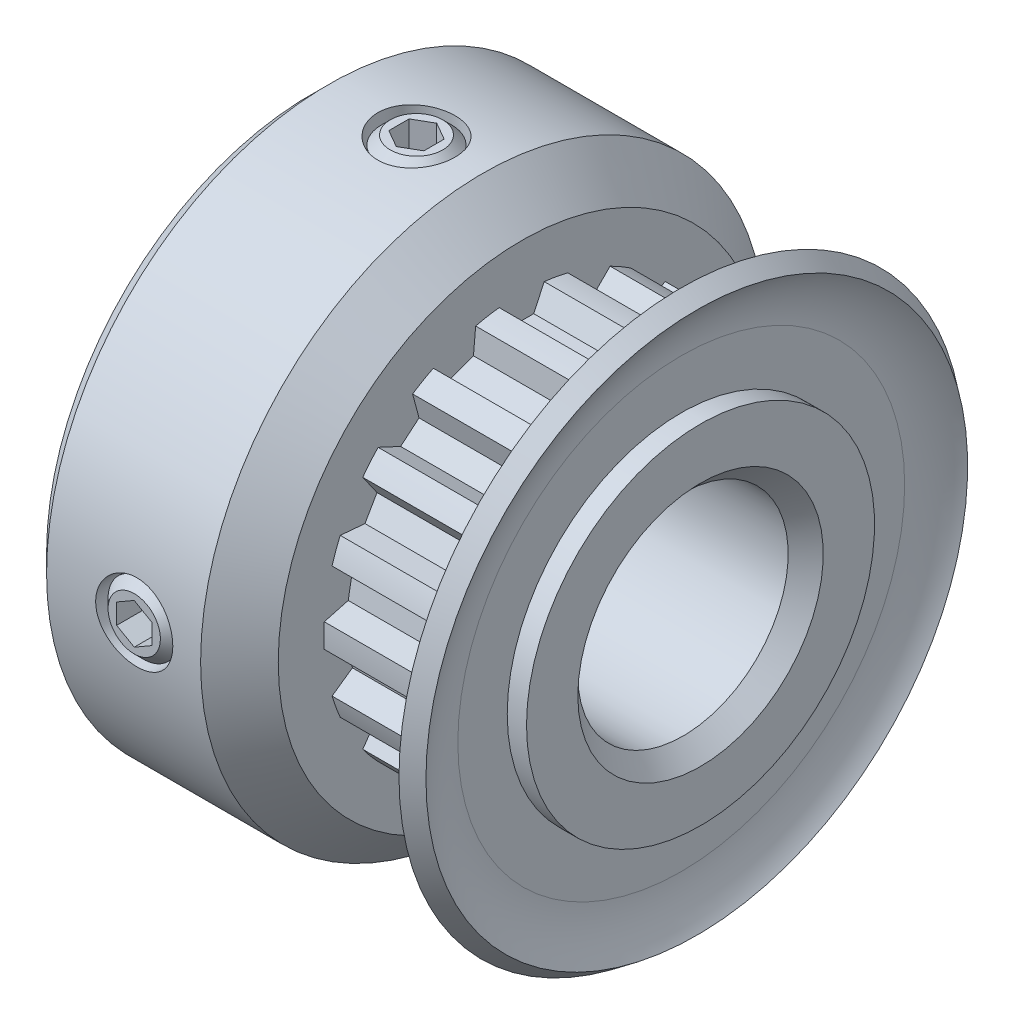
from build123d import *

# Parameters (mm, degrees)
SKETCH4_R          = 5.8
SKETCH4_R_2        = 5.64125
CUT_EXTRUDE2_DEPTH = 4
CUT_EXTRUDE1_DEPTH = 4
CIRPATTERN1_COUNT  = 18
SKETCH6_R          = 1.1
CUT_EXTRUDE3_DEPTH = 13.665208249
CUT_EXTRUDE4_DEPTH = 1.016
CIRPATTERN2_COUNT  = 2
CIRPATTERN2_ANGLE  = 90
CIRPATTERN3_COUNT  = 2
CIRPATTERN3_ANGLE  = 90
CHAMFER1_SIZE      = 0.5


with BuildPart() as part:
    # Sketch1 → Revolve1 (revolve)
    with BuildSketch(Plane.XY, mode=Mode.PRIVATE) as revolve1_sk:
        with BuildLine():
            Line((-5.55, 3), (5.55, 3))
            Line((5.55, 3), (5.55, 8.05))
            Line((5.55, 8.05), (5, 8.05))
            ThreePointArc((5, 8.05), (4.59100507, 7.25465659), (4.45, 6.3715))
            Line((4.45, 6.3715), (4.45, 5.8))
            Line((4.45, 5.8), (0.45, 5.8))
            Line((0.45, 5.8), (0.45, 6.943))
            Line((0.45, 6.943), (-0.657, 8.05))
            Line((-0.657, 8.05), (-5.55, 8.05))
            Line((-5.55, 8.05), (-5.55, 3))
        make_face()
    revolve(revolve1_sk.sketch.rotate(Axis((-5.55, 0, 0), (1, 0, 0)), 90), axis=Axis((-5.55, 0, 0), (1, 0, 0)))

    # Sketch4 → Cut-Extrude2 (cut)
    with BuildSketch(Plane(origin=(0.45, 0, 0), x_dir=(0, 0, -1), z_dir=(1, 0, 0))):
        Circle(SKETCH4_R)
        Circle(SKETCH4_R_2, mode=Mode.SUBTRACT)
    extrude(amount=CUT_EXTRUDE2_DEPTH, mode=Mode.SUBTRACT)

    # Sketch3 → Cut-Extrude1 (cut)
    with BuildSketch(Plane(origin=(0.45, 0, 0), x_dir=(0, 0, -1), z_dir=(1, 0, 0))):
        with BuildLine():
            Line((-0.642345316, 5.604560113), (-0.343021997, 4.962659182))
            Line((-0.343021997, 4.962659182), (0.343021997, 4.962659182))
            Line((0.343021997, 4.962659182), (0.642345316, 5.604560113))
            ThreePointArc((0.642345316, 5.604560113), (0, 5.64125), (-0.642345316, 5.604560113))
        make_face()
    cut_extrude1 = extrude(amount=CUT_EXTRUDE1_DEPTH, mode=Mode.SUBTRACT)

    # CirPattern1: Cut-Extrude1 ×18 about axis
    cirpattern1_axis = Axis((0, 0, 0), (1, 0, 0))
    for i in range(1, CIRPATTERN1_COUNT):
        add(cut_extrude1.rotate(cirpattern1_axis, i * 360 / CIRPATTERN1_COUNT), mode=Mode.SUBTRACT)

    # Sketch6 → Cut-Extrude3 (cut, through all)
    with BuildSketch(Plane(origin=(0, 0, 0), x_dir=(1, 0, 0), z_dir=(0, 1, 0))):
        with Locations(Location((-2.55, 0, 0), (0, 0, 90))):
            Circle(SKETCH6_R)
    cut_extrude3 = extrude(amount=CUT_EXTRUDE3_DEPTH, mode=Mode.SUBTRACT)

    # CirPattern2: Cut-Extrude3 ×2 about axis
    cirpattern2_axis = Axis((-5.55, 0, 0), (1, 0, 0))
    for i in range(1, CIRPATTERN2_COUNT):
        add(cut_extrude3.rotate(cirpattern2_axis, i * CIRPATTERN2_ANGLE / (CIRPATTERN2_COUNT - 1)), mode=Mode.SUBTRACT)

    # Chamfer1
    chamfer1_edges = [part.edges().sort_by_distance(p)[0] for p in [
        (-5.55, 0, -8.05),
        (-5.55, 0, -3),
        (5.55, 0, -3),
    ]]
    chamfer(chamfer1_edges, length=CHAMFER1_SIZE)

    # Sketch9 → Cut-Revolve1 (revolve, cut)
    with BuildSketch(Plane.XY, mode=Mode.PRIVATE) as cut_revolve1_sk:
        with BuildLine():
            Line((5.55, 4.962659182), (5.55, 8.05))
            Line((5.55, 8.05), (5.19262822, 8.312373569))
            Line((5.19262822, 8.312373569), (5, 8.05))
            Line((5, 8.05), (5.44334465, 7.724507264))
            ThreePointArc((5.44334465, 7.724507264), (5.113661534, 7.083395908), (5, 6.3715))
            Line((5, 6.3715), (5, 4.962659182))
            Line((5, 4.962659182), (5.55, 4.962659182))
        make_face()
    revolve(cut_revolve1_sk.sketch.rotate(Axis((-5.55, 0, 0), (1, 0, 0)), 90), axis=Axis((-5.55, 0, 0), (1, 0, 0)), mode=Mode.SUBTRACT)


with BuildPart() as body_2:
    # Sketch7 → Revolve2 (revolve)
    with BuildSketch(Plane.XY, mode=Mode.PRIVATE) as revolve2_sk:
        Polygon((-3.296, 8.05), (-2.55, 8.05), (-2.55, 3.381), (-3.296, 3.381), (-3.55, 3.635), (-3.55, 7.796), align=None)
    revolve(revolve2_sk.sketch.rotate(Axis((-2.55, 3.381, 0), (0, 1, 0)), 270), axis=Axis((-2.55, 3.381, 0), (0, 1, 0)))

    # Sketch8 → Cut-Extrude4 (cut)
    with BuildSketch(Plane(origin=(0, 8.05, 0), x_dir=(1, 0, 0), z_dir=(0, 1, 0))):
        Polygon((-2.55, 0.577350269), (-3.05, 0.288675135), (-3.05, -0.288675135), (-2.55, -0.577350269), (-2.05, -0.288675135), (-2.05, 0.288675135), align=None)
    extrude(amount=-CUT_EXTRUDE4_DEPTH, mode=Mode.SUBTRACT)


with BuildPart() as cirpattern3_1:
    # CirPattern3: pattern copy
    add(body_2.part.rotate(Axis((0, 0, 0), (1, 0, 0)), 1 * CIRPATTERN3_ANGLE / (CIRPATTERN3_COUNT - 1)))


solid = Compound([part.part, body_2.part, cirpattern3_1.part])
